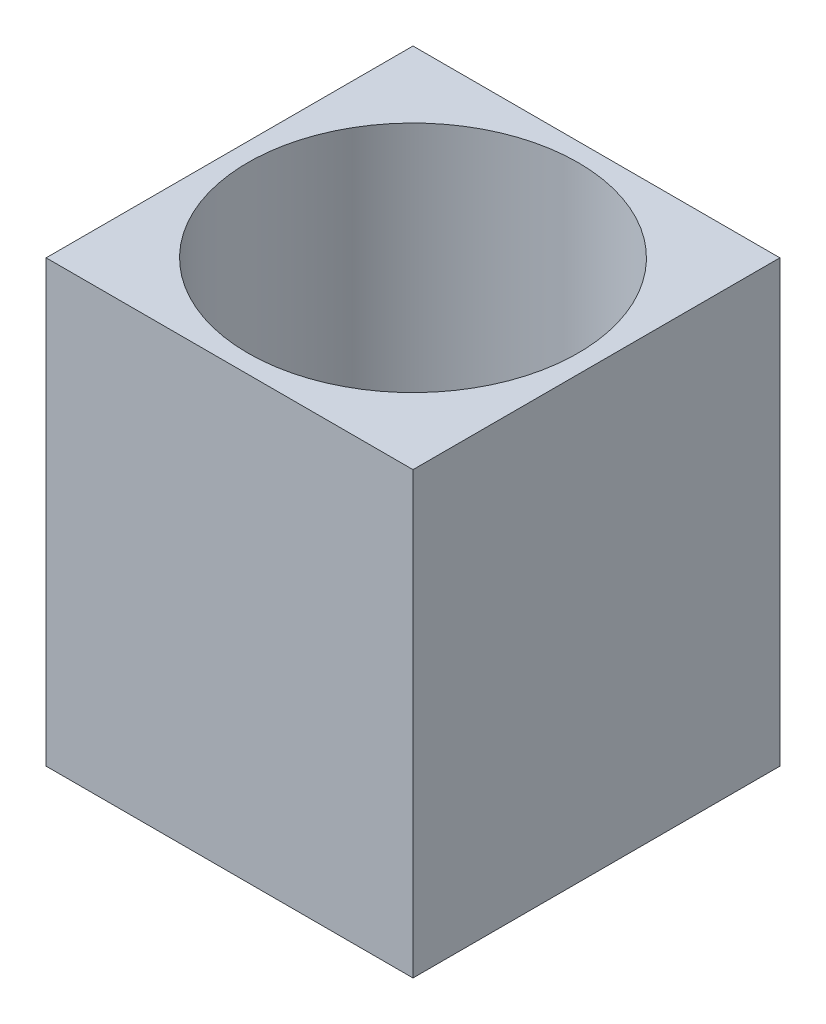
from build123d import *

# Parameters (mm, degrees)
BOSS_EXTRUDE1_DEPTH      = 508
BOSS_EXTRUDE1_DEPTH_BACK = 254
SKETCH1_W                = 635
SKETCH1_H                = 635
SKETCH1_R                = 285.75


with BuildPart() as part:
    # Sketch1 → Boss-Extrude1 (new, two sides: drawn at the far end of the back side and taken through both)
    with BuildSketch(Plane(origin=(0, 0, 0), x_dir=(1, 0, 0), z_dir=(0, 1, 0)).offset(-BOSS_EXTRUDE1_DEPTH_BACK)):
        Rectangle(SKETCH1_W, SKETCH1_H)
        Circle(SKETCH1_R, mode=Mode.SUBTRACT)
    extrude(amount=BOSS_EXTRUDE1_DEPTH + BOSS_EXTRUDE1_DEPTH_BACK)


solid = part.part
